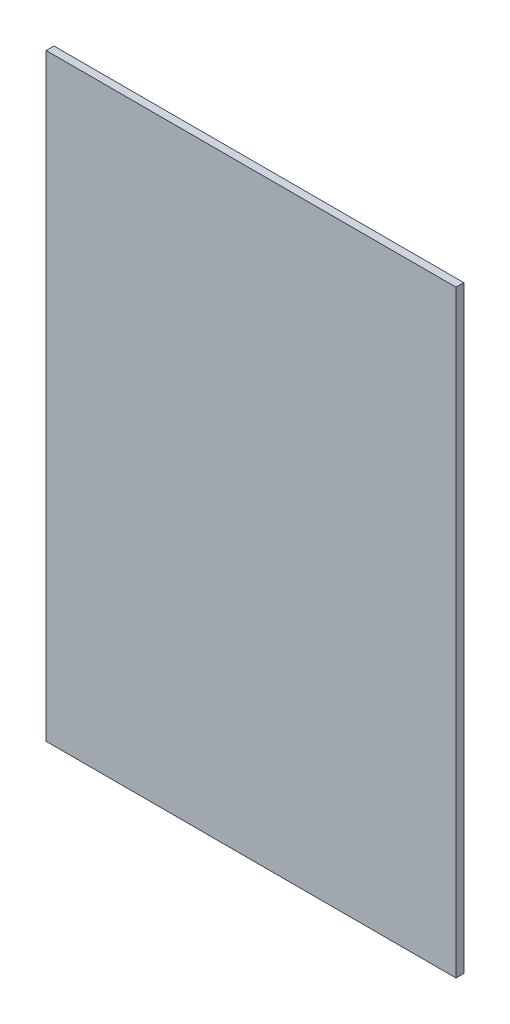
from build123d import *

# Parameters (mm, degrees)
SKETCH1_W           = 166.124
SKETCH1_H           = 242.52
BOSS_EXTRUDE1_DEPTH = 3.175


with BuildPart() as part:
    # Sketch1 → Boss-Extrude1 (new body)
    with BuildSketch(Plane.XY):
        with Locations((83.062, 121.26)):
            Rectangle(SKETCH1_W, SKETCH1_H)
    extrude(amount=BOSS_EXTRUDE1_DEPTH)


solid = part.part
